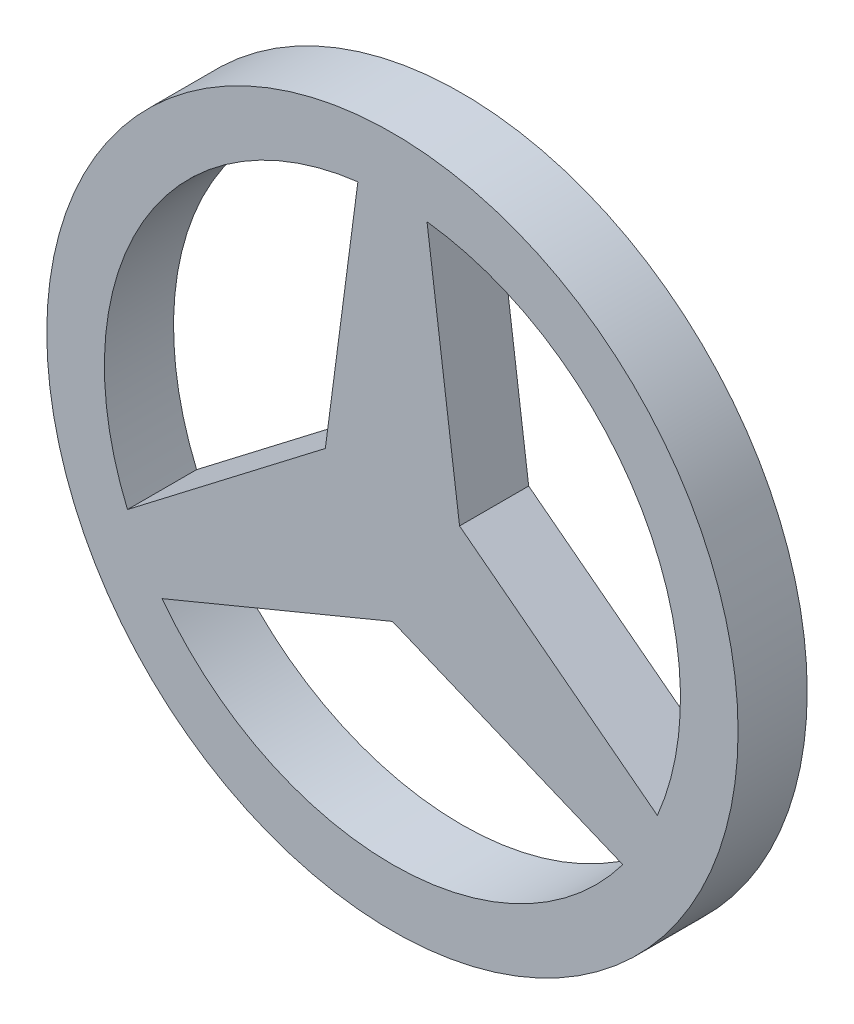
from build123d import *

# Parameters (mm, degrees)
SKETCH_1_R      = 15
SKETCH_1_R_2    = 12.5
EXTRUDE_1_DEPTH = 3


with BuildPart() as part:
    # 草图1 → 凸台-拉伸1 (new body)
    # profile 1 of 2: a face of its own
    with BuildSketch(Plane.XY):
        Circle(SKETCH_1_R)
        Circle(SKETCH_1_R_2, mode=Mode.SUBTRACT)
    # profile 2 of 2: a face of its own
    with BuildSketch(Plane.XY):
        with BuildLine():
            ThreePointArc((1.5, 12.409673646), (0, 12.5), (-1.5, 12.409673646))
            Line((-1.5, 12.409673646), (-2.912394569, 1.681471788))
            Line((-2.912394569, 1.681471788), (-11.49709263, -4.905798717))
            ThreePointArc((-11.49709263, -4.905798717), (-10.825317547, -6.25), (-9.99709263, -7.503874929))
            Line((-9.99709263, -7.503874929), (0, -3.362943577))
            Line((0, -3.362943577), (9.99709263, -7.503874929))
            ThreePointArc((9.99709263, -7.503874929), (10.825317547, -6.25), (11.49709263, -4.905798717))
            Line((11.49709263, -4.905798717), (2.912394569, 1.681471788))
            Line((2.912394569, 1.681471788), (1.5, 12.409673646))
        make_face()
    extrude(amount=EXTRUDE_1_DEPTH)


solid = part.part
